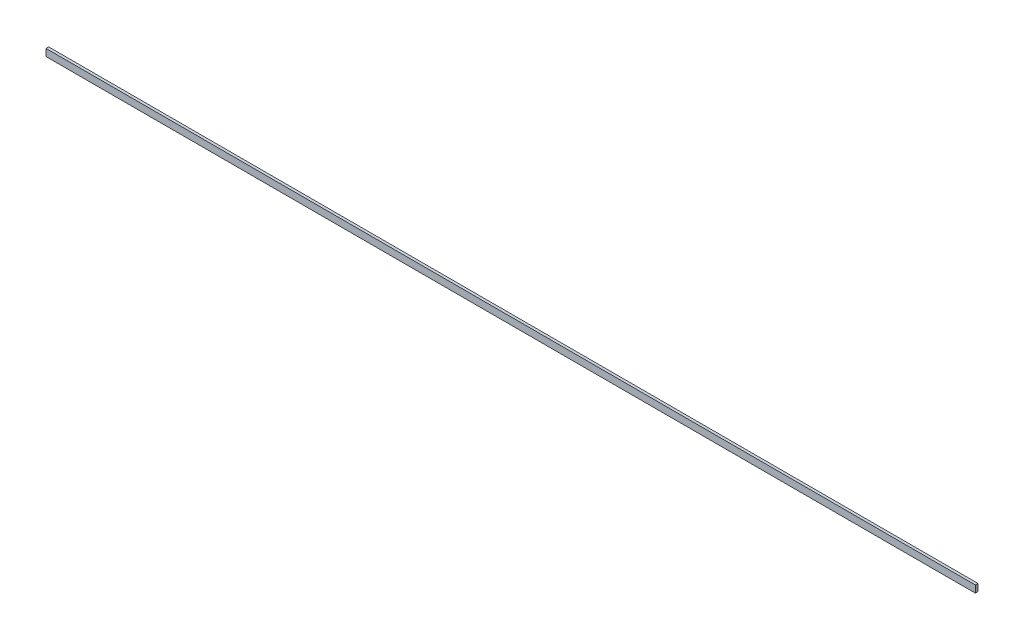
from build123d import *

# Parameters (mm, degrees)
SKETCH_1_W      = 525
SKETCH_1_H      = 4
EXTRUDE_1_DEPTH = 1.5


with BuildPart() as part:
    # 草图1 → 凸台-拉伸1 (new body)
    with BuildSketch(Plane.XY):
        with Locations((262.5, -2)):
            Rectangle(SKETCH_1_W, SKETCH_1_H)
    extrude(amount=EXTRUDE_1_DEPTH)


solid = part.part
